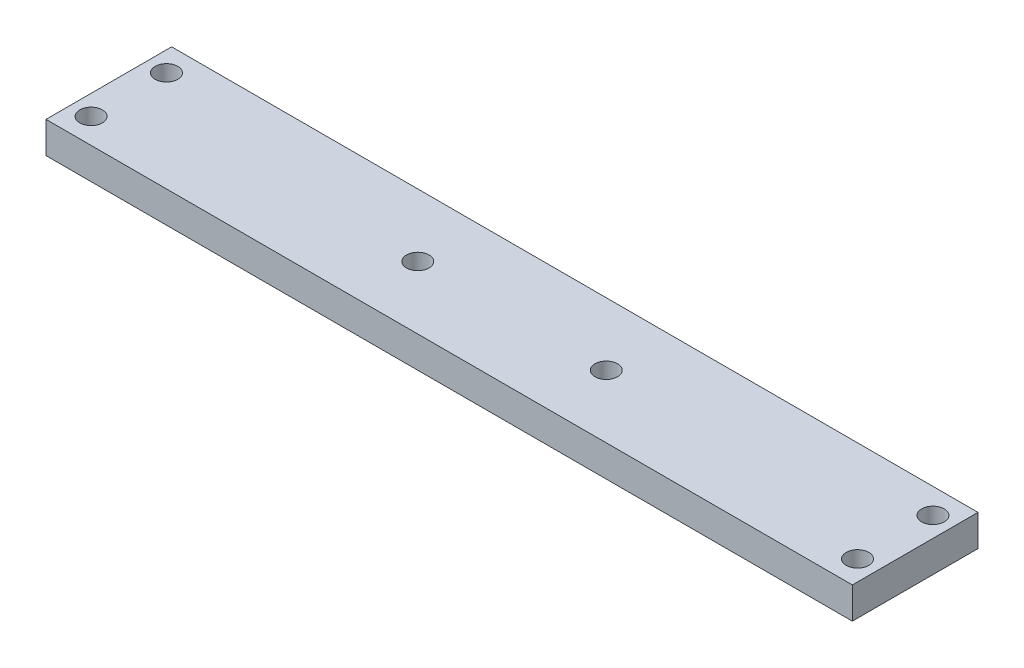
from build123d import *

# Parameters (mm, degrees)
SKETCH2_W            = 128.35
SKETCH2_H            = 20
BOSS_EXTRUDE1_DEPTH  = 5
M3_CLEARANCE_HOLE1_D = 3.6
M3_CLEARANCE_HOLE2_D = 3.6


with BuildPart() as part:
    # Sketch2 → Boss-Extrude1 (new body)
    with BuildSketch(Plane(origin=(0, 0, 0), x_dir=(1, 0, 0), z_dir=(0, 1, 0))):
        with Locations((24.337601626, 10.975609756)):
            Rectangle(SKETCH2_W, SKETCH2_H)
    extrude(amount=BOSS_EXTRUDE1_DEPTH)

    # M3 Clearance Hole1 (through all)
    with Locations(Plane(origin=(0, 5, 0), x_dir=(1, 0, 0), z_dir=(0, 1, 0))):
        with Locations((-36.662398374, 16.975609756), (-36.662398374, 4.975609756), (85.337601626, 16.975609756), (85.337601626, 4.975609756)):
            Hole(M3_CLEARANCE_HOLE1_D / 2)

    # M3 Clearance Hole2 (through all)
    with Locations(Plane(origin=(0, 5, 0), x_dir=(1, 0, 0), z_dir=(0, 1, 0))):
        with Locations((9.337601626, 10.975609756), (39.337601626, 10.975609756)):
            Hole(M3_CLEARANCE_HOLE2_D / 2)


solid = part.part
